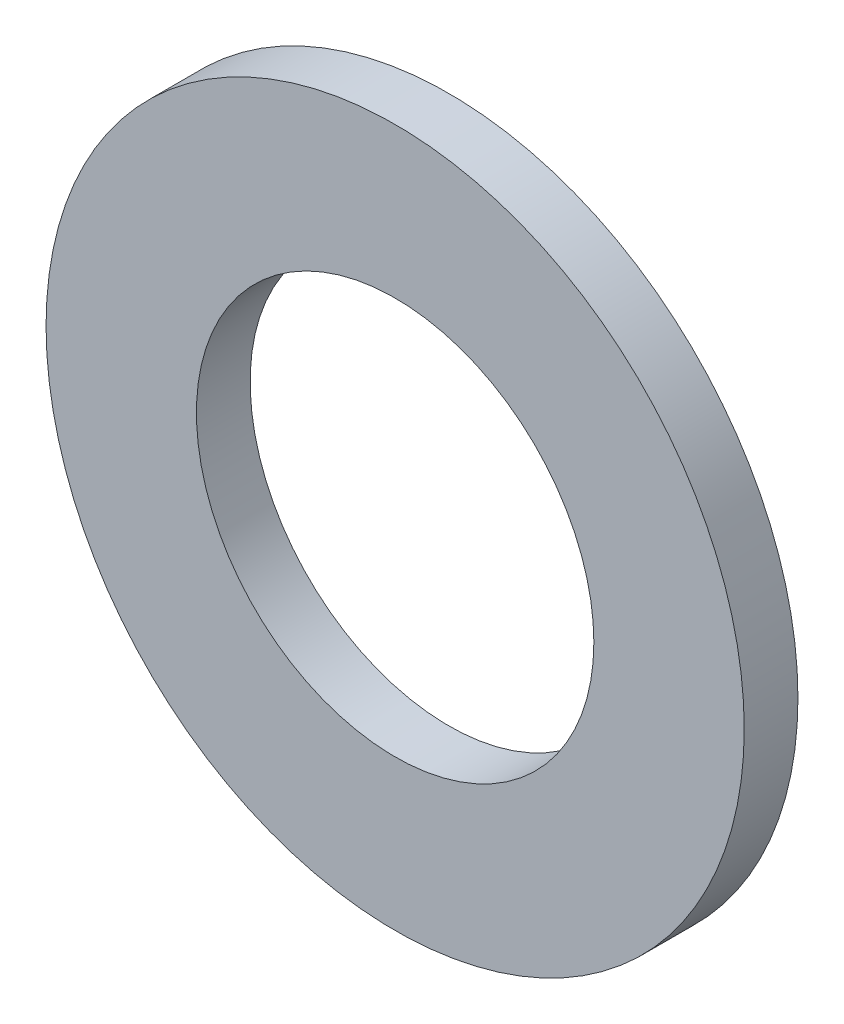
from build123d import *

# Parameters (mm, degrees)
SKETCH_1_R      = 32.5
SKETCH_1_R_2    = 18.5
EXTRUDE_1_DEPTH = 5


with BuildPart() as part:
    # 草图1 → 凸台-拉伸1 (new body)
    with BuildSketch(Plane.XY):
        Circle(SKETCH_1_R)
        Circle(SKETCH_1_R_2, mode=Mode.SUBTRACT)
    extrude(amount=EXTRUDE_1_DEPTH)


solid = part.part
